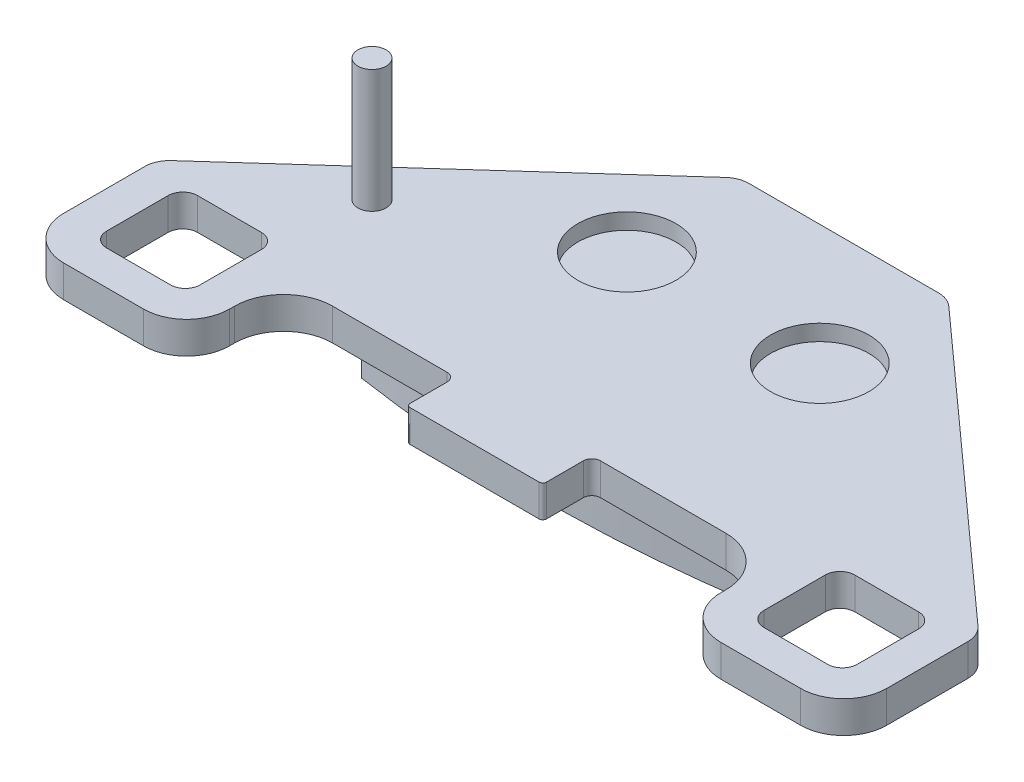
from build123d import *

# Parameters (mm, degrees)
BOSS_EXTRUDE1_DEPTH = 3.302
SKETCH3_R           = 5.08
CUT_EXTRUDE1_DEPTH  = 1.651
BOSS_EXTRUDE2_DEPTH = 4.445
SKETCH5_R           = 1.4605
BOSS_EXTRUDE3_DEPTH = 12.7


with BuildPart() as part:
    # Sketch1 → Boss-Extrude1 (new body)
    with BuildSketch(Plane(origin=(0, 0, 0), x_dir=(1, 0, 0), z_dir=(0, 1, 0))):
        with BuildLine():
            ThreePointArc((42.545, -8.433720508), (42.325290161, -7.400350502), (41.704170418, -6.545753376))
            Line((41.704170418, -6.545753376), (11.519480965, 20.620467131))
            ThreePointArc((11.519480965, 20.620467131), (10.730300515, 21.103895846), (9.820310547, 21.2725))
            Line((9.820310547, 21.2725), (-9.820310547, 21.2725))
            ThreePointArc((-9.820310547, 21.2725), (-10.730300515, 21.103895846), (-11.519480965, 20.620467131))
            Line((-11.519480965, 20.620467131), (-41.704170418, -6.545753376))
            ThreePointArc((-41.704170418, -6.545753376), (-42.325290161, -7.400350502), (-42.545, -8.433720508))
            Line((-42.545, -8.433720508), (-42.545, -16.8275))
            ThreePointArc((-42.545, -16.8275), (-41.243089642, -19.970589642), (-38.1, -21.2725))
            Line((-38.1, -21.2725), (-29.845, -21.2725))
            ThreePointArc((-29.845, -21.2725), (-26.701910358, -19.970589642), (-25.4, -16.8275))
            Line((-25.4, -16.8275), (-25.4, -16.3195))
            ThreePointArc((-25.4, -16.3195), (-23.912102448, -12.727397552), (-20.32, -11.2395))
            Line((-20.32, -11.2395), (-8.505751918, -11.2395))
            ThreePointArc((-8.505751918, -11.2395), (-7.87713399, -11.499882072), (-7.616751918, -12.1285))
            Line((-7.616751918, -12.1285), (-7.616751918, -15.9385))
            ThreePointArc((-7.616751918, -15.9385), (-7.505159602, -16.207907684), (-7.235751918, -16.3195))
            Line((-7.235751918, -16.3195), (6.099248082, -16.3195))
            ThreePointArc((6.099248082, -16.3195), (6.368655765, -16.207907684), (6.480248082, -15.9385))
            Line((6.480248082, -15.9385), (6.480248082, -12.1285))
            ThreePointArc((6.480248082, -12.1285), (6.740630153, -11.499882072), (7.369248082, -11.2395))
            Line((7.369248082, -11.2395), (20.32, -11.2395))
            ThreePointArc((20.32, -11.2395), (23.912102448, -12.727397552), (25.4, -16.3195))
            Line((25.4, -16.3195), (25.4, -16.8275))
            ThreePointArc((25.4, -16.8275), (26.701910358, -19.970589642), (29.845, -21.2725))
            Line((29.845, -21.2725), (38.1, -21.2725))
            ThreePointArc((38.1, -21.2725), (41.243089642, -19.970589642), (42.545, -16.8275))
            Line((42.545, -16.8275), (42.545, -8.433720508))
        make_face()
        with BuildLine():
            ThreePointArc((-38.735, -9.8425), (-38.288630735, -8.764869265), (-37.211, -8.3185))
            Line((-37.211, -8.3185), (-30.607, -8.3185))
            ThreePointArc((-30.607, -8.3185), (-29.529369265, -8.764869265), (-29.083, -9.8425))
            Line((-29.083, -9.8425), (-29.083, -16.1925))
            ThreePointArc((-29.083, -16.1925), (-29.529369265, -17.270130735), (-30.607, -17.7165))
            Line((-30.607, -17.7165), (-37.211, -17.7165))
            ThreePointArc((-37.211, -17.7165), (-38.288630735, -17.270130735), (-38.735, -16.1925))
            Line((-38.735, -16.1925), (-38.735, -9.8425))
        make_face(mode=Mode.SUBTRACT)
        with BuildLine():
            Line((30.734, -8.3185), (37.338, -8.3185))
            ThreePointArc((37.338, -8.3185), (38.415630735, -8.764869265), (38.862, -9.8425))
            Line((38.862, -9.8425), (38.862, -16.1925))
            ThreePointArc((38.862, -16.1925), (38.415630735, -17.270130735), (37.338, -17.7165))
            Line((37.338, -17.7165), (30.734, -17.7165))
            ThreePointArc((30.734, -17.7165), (29.656369265, -17.270130735), (29.21, -16.1925))
            Line((29.21, -16.1925), (29.21, -9.8425))
            ThreePointArc((29.21, -9.8425), (29.656369265, -8.764869265), (30.734, -8.3185))
        make_face(mode=Mode.SUBTRACT)
    extrude(amount=BOSS_EXTRUDE1_DEPTH)

    # Sketch3 → Cut-Extrude1 (cut)
    with BuildSketch(Plane(origin=(0, 3.302, 0), x_dir=(1, 0, 0), z_dir=(0, 1, 0))):
        with Locations(Location((-9.9695, 8.8265, 0), (0, 0, 270))):
            Circle(SKETCH3_R)
        with Locations(Location((9.9695, 8.8265, 0), (0, 0, 270))):
            Circle(SKETCH3_R)
    extrude(amount=-CUT_EXTRUDE1_DEPTH, mode=Mode.SUBTRACT)

    # Sketch4 → Boss-Extrude2 (add)
    with BuildSketch(Plane.XZ):
        with BuildLine():
            ThreePointArc((-20.1295, 8.4455), (0, 9.9695), (20.1295, 8.4455))
            Line((20.1295, 8.4455), (20.1295, -11.72845))
            Line((20.1295, -11.72845), (10.795, -20.1295))
            Line((10.795, -20.1295), (-10.795, -20.1295))
            Line((-10.795, -20.1295), (-20.1295, -11.72845))
            Line((-20.1295, -11.72845), (-20.1295, 8.4455))
        make_face()
    extrude(amount=BOSS_EXTRUDE2_DEPTH)

    # Sketch5 → Boss-Extrude3 (add)
    with BuildSketch(Plane(origin=(0, 3.302, 0), x_dir=(1, 0, 0), z_dir=(0, 1, 0))):
        with Locations(Location((-27.813, 0.3175, 0), (0, 0, 270))):
            Circle(SKETCH5_R)
    extrude(amount=BOSS_EXTRUDE3_DEPTH)


solid = part.part
